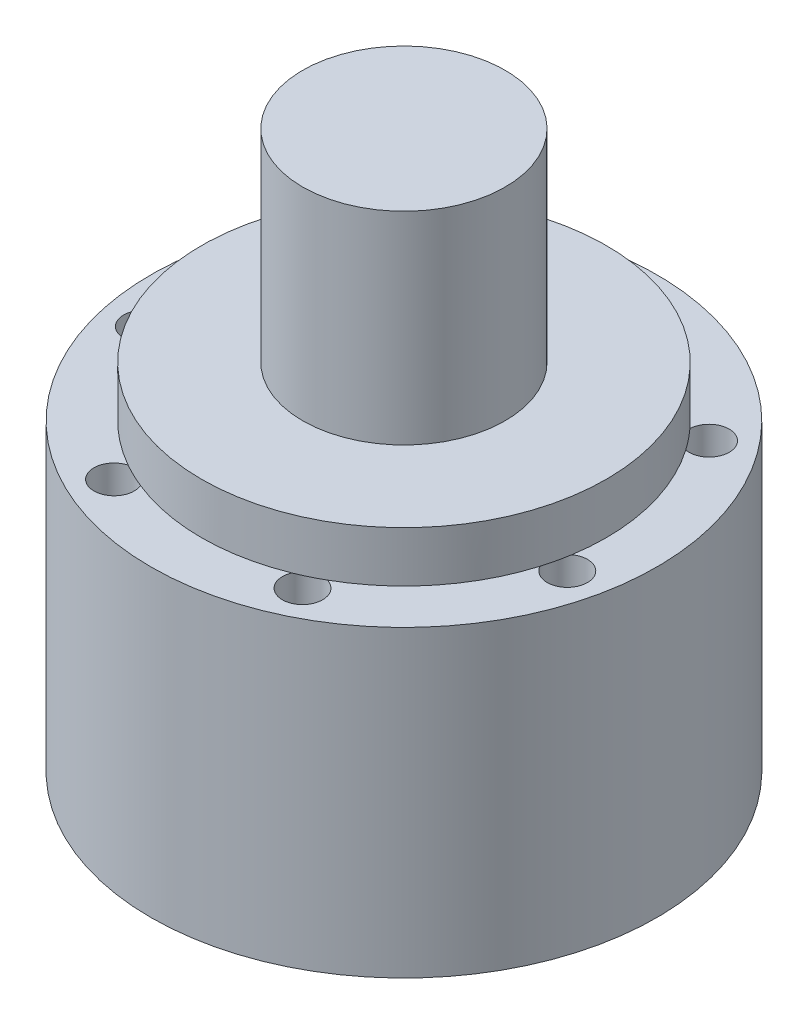
from build123d import *

# Parameters (mm, degrees)
SKETCH_1_R      = 25
SKETCH_1_R_2    = 1.326040619
SKETCH_1_R_3    = 1.707538373
SKETCH_1_R_4    = 1.989060928
SKETCH_1_R_5    = 1.868114934
EXTRUDE_1_DEPTH = 30
SKETCH_2_R      = 20
EXTRUDE_2_DEPTH = 5
SKETCH_3_R      = 10
EXTRUDE_3_DEPTH = 20


with BuildPart() as part:
    # 草图1 → 凸台-拉伸1 (new body)
    with BuildSketch(Plane(origin=(0, 0, 0), x_dir=(1, 0, 0), z_dir=(0, 1, 0))):
        with Locations(Location((0, 0, 0), (0, 0, 270))):
            Circle(SKETCH_1_R)
        with Locations(Location((0, 3.551894514, 0), (0, 0, 270))):
            Circle(SKETCH_1_R_2, mode=Mode.SUBTRACT)
        with Locations(Location((0, 8.19303668, 0), (0, 0, 270))):
            Circle(SKETCH_1_R_3, mode=Mode.SUBTRACT)
        with Locations(Location((0, 21.453442867, 0), (0, 0, 270))):
            Circle(SKETCH_1_R_4, mode=Mode.SUBTRACT)
        with Locations(Location((0, 14.349653838, 0), (0, 0, 270))):
            Circle(SKETCH_1_R_5, mode=Mode.SUBTRACT)
        with Locations(Location((2.776982954, 2.214570007, 0), (0, 0, 270))):
            Circle(SKETCH_1_R_2, mode=Mode.SUBTRACT)
        with Locations(Location((6.405574013, 5.108274816, 0), (0, 0, 270))):
            Circle(SKETCH_1_R_3, mode=Mode.SUBTRACT)
        with Locations(Location((11.219011133, 8.946862828, 0), (0, 0, 270))):
            Circle(SKETCH_1_R_5, mode=Mode.SUBTRACT)
        with Locations(Location((16.77297704, 13.376002842, 0), (0, 0, 270))):
            Circle(SKETCH_1_R_4, mode=Mode.SUBTRACT)
        with Locations(Location((3.462841103, -0.790370885, 0), (0, 0, 270))):
            Circle(SKETCH_1_R_2, mode=Mode.SUBTRACT)
        with Locations(Location((7.987620145, -1.823122174, 0), (0, 0, 270))):
            Circle(SKETCH_1_R_3, mode=Mode.SUBTRACT)
        with Locations(Location((13.989878057, -3.193098374, 0), (0, 0, 270))):
            Circle(SKETCH_1_R_5, mode=Mode.SUBTRACT)
        with Locations(Location((20.915560263, -4.773840143, 0), (0, 0, 270))):
            Circle(SKETCH_1_R_4, mode=Mode.SUBTRACT)
        with Locations(Location((1.541109273, -3.200146379, 0), (0, 0, 270))):
            Circle(SKETCH_1_R_2, mode=Mode.SUBTRACT)
        with Locations(Location((3.554825389, -7.381670982, 0), (0, 0, 270))):
            Circle(SKETCH_1_R_3, mode=Mode.SUBTRACT)
        with Locations(Location((6.226081462, -12.928591373, 0), (0, 0, 270))):
            Circle(SKETCH_1_R_5, mode=Mode.SUBTRACT)
        with Locations(Location((9.308300008, -19.328884132, 0), (0, 0, 270))):
            Circle(SKETCH_1_R_4, mode=Mode.SUBTRACT)
        with Locations(Location((-1.541109273, -3.200146379, 0), (0, 0, 270))):
            Circle(SKETCH_1_R_2, mode=Mode.SUBTRACT)
        with Locations(Location((-3.554825389, -7.381670982, 0), (0, 0, 270))):
            Circle(SKETCH_1_R_3, mode=Mode.SUBTRACT)
        with Locations(Location((-6.226081462, -12.928591373, 0), (0, 0, 270))):
            Circle(SKETCH_1_R_5, mode=Mode.SUBTRACT)
        with Locations(Location((-9.308300008, -19.328884132, 0), (0, 0, 270))):
            Circle(SKETCH_1_R_4, mode=Mode.SUBTRACT)
        with Locations(Location((-3.462841103, -0.790370885, 0), (0, 0, 270))):
            Circle(SKETCH_1_R_2, mode=Mode.SUBTRACT)
        with Locations(Location((-7.987620145, -1.823122174, 0), (0, 0, 270))):
            Circle(SKETCH_1_R_3, mode=Mode.SUBTRACT)
        with Locations(Location((-13.989878057, -3.193098374, 0), (0, 0, 270))):
            Circle(SKETCH_1_R_5, mode=Mode.SUBTRACT)
        with Locations(Location((-20.915560263, -4.773840143, 0), (0, 0, 270))):
            Circle(SKETCH_1_R_4, mode=Mode.SUBTRACT)
        with Locations(Location((-2.776982954, 2.214570007, 0), (0, 0, 270))):
            Circle(SKETCH_1_R_2, mode=Mode.SUBTRACT)
        with Locations(Location((-6.405574013, 5.108274816, 0), (0, 0, 270))):
            Circle(SKETCH_1_R_3, mode=Mode.SUBTRACT)
        with Locations(Location((-11.219011133, 8.946862828, 0), (0, 0, 270))):
            Circle(SKETCH_1_R_5, mode=Mode.SUBTRACT)
        with Locations(Location((-16.77297704, 13.376002842, 0), (0, 0, 270))):
            Circle(SKETCH_1_R_4, mode=Mode.SUBTRACT)
    extrude(amount=EXTRUDE_1_DEPTH)

    # 草图2 → 凸台-拉伸2 (add)
    with BuildSketch(Plane(origin=(0, 30, 0), x_dir=(1, 0, 0), z_dir=(0, 1, 0))):
        with Locations(Location((0, 0, 0), (0, 0, 86.243341215))):
            Circle(SKETCH_2_R)
    extrude(amount=EXTRUDE_2_DEPTH)

    # 草图3 → 凸台-拉伸3 (add)
    with BuildSketch(Plane(origin=(0, 35, 0), x_dir=(1, 0, 0), z_dir=(0, 1, 0))):
        with Locations(Location((0, 0, 0), (0, 0, 270))):
            Circle(SKETCH_3_R)
    extrude(amount=EXTRUDE_3_DEPTH)


solid = part.part
